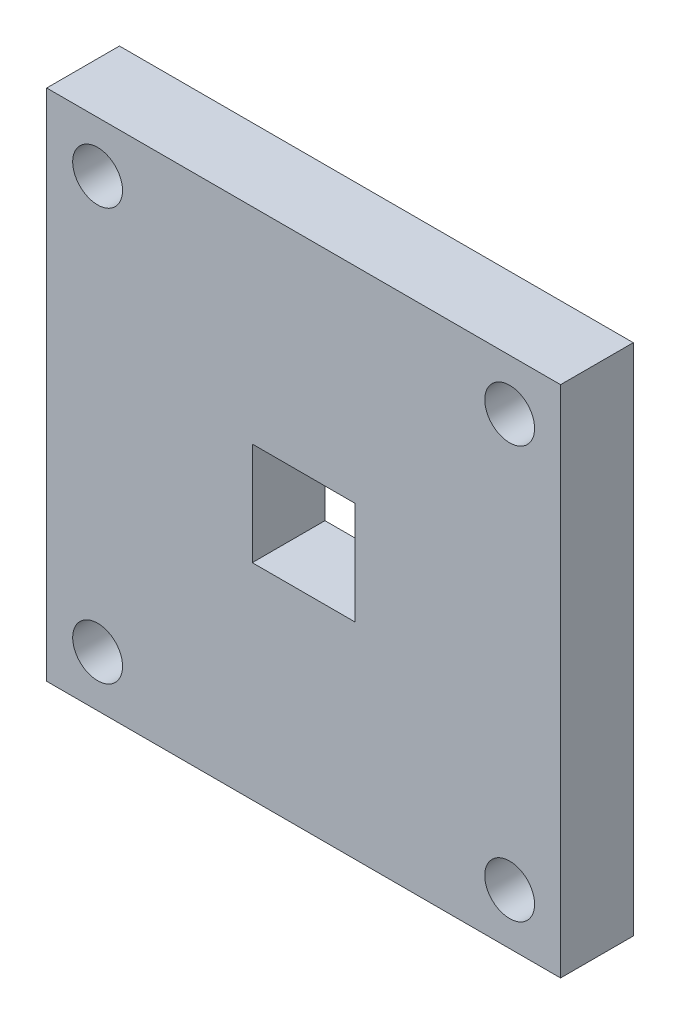
from build123d import *

# Parameters (mm, degrees)
SKETCH2_W                 = 33.655
SKETCH2_H                 = 33.655
BOSS_EXTRUDE1_DEPTH       = 2.38125
CUT_EXTRUDE1_REACH        = 26.27
SKETCH3_W                 = 6.731
SKETCH3_H                 = 6.731
F_4_CLEARANCE_HOLE1_D     = 3.2639
F_4_CLEARANCE_HOLE1_DEPTH = 8.89
F_4_CLEARANCE_HOLE1_TIP   = 0.980574487


with BuildPart() as part:
    # Sketch2 → Boss-Extrude1 (new, symmetric)
    with BuildSketch(Plane.XY):
        Rectangle(SKETCH2_W, SKETCH2_H)
    extrude(amount=BOSS_EXTRUDE1_DEPTH, both=True)

    # Sketch3 → Cut-Extrude1 (cut, up to next)
    with BuildSketch(Plane.XY.offset(2.38125), mode=Mode.PRIVATE) as cut_extrude1_sk1:
        Rectangle(SKETCH3_W, SKETCH3_H)
    cut_extrude1_tool1 = extrude(cut_extrude1_sk1.sketch, amount=-CUT_EXTRUDE1_REACH, mode=Mode.PRIVATE) & part.part
    add(cut_extrude1_tool1.solids().sort_by_distance((0, 0, 2.38125))[0], mode=Mode.SUBTRACT)

    # #4 Clearance Hole1
    with Locations(Plane.XY.offset(2.38125)):
        with Locations((-13.49375, 13.49375), (0, 0), (13.49375, 13.49375), (-13.49375, -13.49375), (13.49375, -13.49375)):
            Hole(F_4_CLEARANCE_HOLE1_D / 2, depth=F_4_CLEARANCE_HOLE1_DEPTH)
            with Locations((0, 0, -(F_4_CLEARANCE_HOLE1_DEPTH + F_4_CLEARANCE_HOLE1_TIP / 2))):  # 118° drill point
                Cone(0, F_4_CLEARANCE_HOLE1_D / 2, F_4_CLEARANCE_HOLE1_TIP, mode=Mode.SUBTRACT)


solid = part.part
